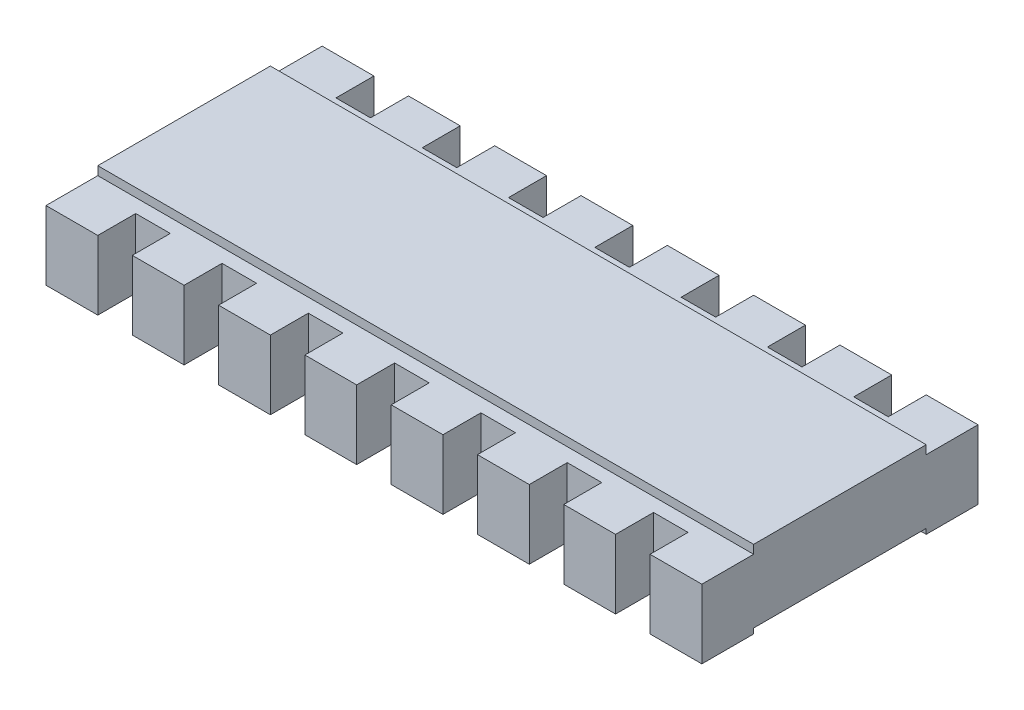
from build123d import *

# Parameters (mm, degrees)
BOSS_EXTRUDE1_START = 0.03
SKETCH1_W           = 3.8
SKETCH1_H           = 1
BOSS_EXTRUDE1_DEPTH = 0.42
BOSS_EXTRUDE2_DEPTH = 0.4


with BuildPart() as part:
    # Sketch1 → Boss-Extrude1 (new body)
    with BuildSketch(Plane(origin=(0, 0, 0), x_dir=(1, 0, 0), z_dir=(0, 1, 0)).offset(BOSS_EXTRUDE1_START)):
        Rectangle(SKETCH1_W, SKETCH1_H)
    extrude(amount=BOSS_EXTRUDE1_DEPTH)

    # Sketch2 → Boss-Extrude2 (add)
    with BuildSketch(Plane(origin=(0, 0, 0), x_dir=(1, 0, 0), z_dir=(0, 1, 0))):
        Polygon((1.9, 0.5), (-1.9, 0.5), (-1.9, 0.8), (-1.6, 0.8), (-1.6, 0.58), (-1.4, 0.58), (-1.4, 0.8), (-1.1, 0.8), (-1.1, 0.58), (-0.9, 0.58), (-0.9, 0.8), (-0.6, 0.8), (-0.6, 0.58), (-0.4, 0.58), (-0.4, 0.8), (-0.1, 0.8), (-0.1, 0.58), (0.1, 0.58), (0.1, 0.8), (0.4, 0.8), (0.4, 0.58), (0.6, 0.58), (0.6, 0.8), (0.9, 0.8), (0.9, 0.58), (1.1, 0.58), (1.1, 0.8), (1.4, 0.8), (1.4, 0.58), (1.6, 0.58), (1.6, 0.8), (1.9, 0.8), align=None)
    boss_extrude2 = extrude(amount=BOSS_EXTRUDE2_DEPTH)

    # Mirror1: Boss-Extrude2 across plane
    add(boss_extrude2.mirror(Plane.XY))


solid = part.part
